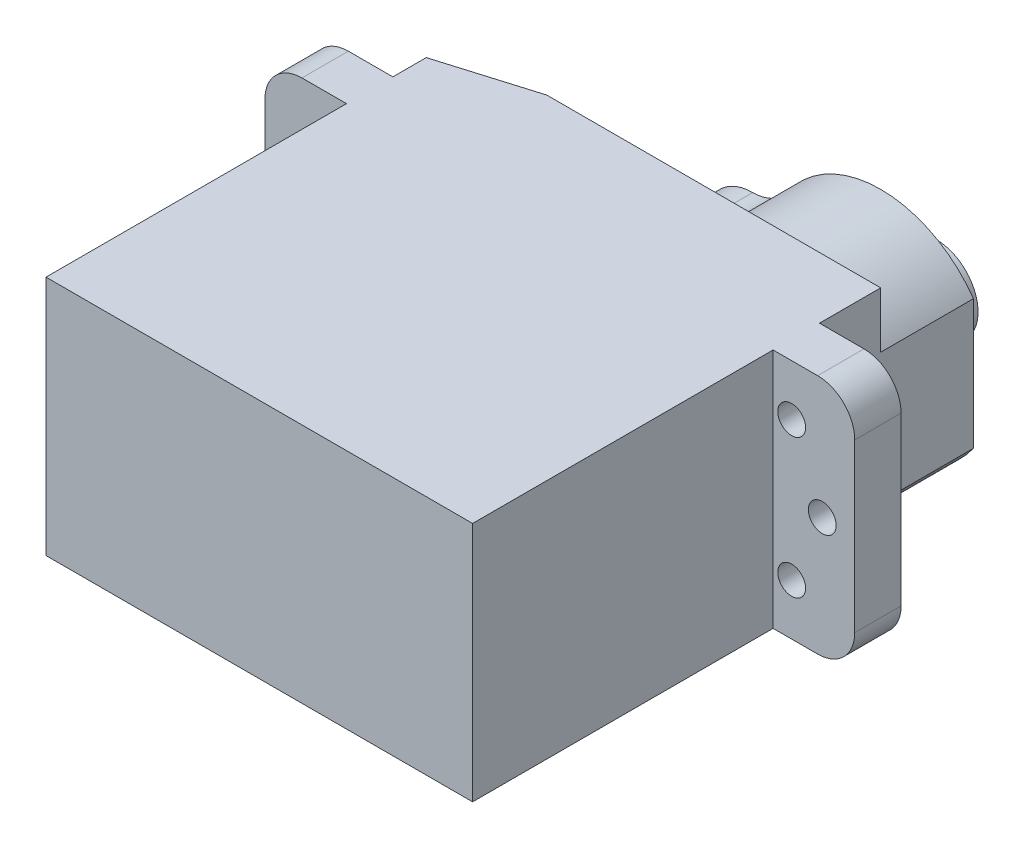
from build123d import *

# Parameters (mm, degrees)
BOSS_EXTRUDE1_DEPTH = 13
BOSS_EXTRUDE2_DEPTH = 5
FILLET1_R           = 2
SKETCH3_R           = 0.75
CUT_EXTRUDE1_DEPTH  = 4.9
SKETCH4_R           = 2.25
BOSS_EXTRUDE3_DEPTH = 3


with BuildPart() as part:
    # Sketch1 → Boss-Extrude1 (new body)
    with BuildSketch(Plane(origin=(0, 0, 0), x_dir=(1, 0, 0), z_dir=(0, 1, 0))):
        Polygon((0, 20.5), (5, 22), (11.5, 22), (23, 22), (23, 18.7), (27.4, 18.7), (27.4, 16.2), (23, 16.2), (23, 0), (0, 0), (0, 16.2), (-4.4, 16.2), (-4.4, 18.7), (0, 18.7), align=None)
    extrude(amount=BOSS_EXTRUDE1_DEPTH)

    # Sketch2 → Boss-Extrude2 (add)
    with BuildSketch(Plane(origin=(0, 0, -22), x_dir=(-1, 0, 0), z_dir=(0, 0, -1))):
        with BuildLine():
            Line((-23, 9.994281042), (-23, 3.005718958))
            ThreePointArc((-23, 3.005718958), (-17.997144773, 0.400000668), (-12.996731055, 3.010401189))
            ThreePointArc((-12.996731055, 3.010401189), (-12.16968389, 3.737727457), (-11.1, 4))
            ThreePointArc((-11.1, 4), (-8.6, 6.5), (-11.1, 9))
            ThreePointArc((-11.1, 9), (-12.16968389, 9.262272543), (-12.996731055, 9.989598811))
            ThreePointArc((-12.996731055, 9.989598811), (-17.997144773, 12.599999332), (-23, 9.994281042))
        make_face()
    extrude(amount=BOSS_EXTRUDE2_DEPTH)

    # Fillet1
    fillet1_edges = [part.edges().sort_by_distance(p)[0] for p in [
        (-4.4, 0, -17.45),
        (27.4, 13, -17.45),
        (27.4, 0, -17.45),
        (-4.4, 13, -17.45),
    ]]
    fillet(fillet1_edges, radius=FILLET1_R)

    # Sketch3 → Cut-Extrude1 (cut)
    with BuildSketch(Plane(origin=(0, 0, -18.7), x_dir=(-1, 0, 0), z_dir=(0, 0, -1))):
        with Locations((-25.65, 6.5)):
            Circle(SKETCH3_R)
        with Locations((-24, 10.25)):
            Circle(SKETCH3_R)
        with Locations((-24, 2.75)):
            Circle(SKETCH3_R)
        with Locations((1, 2.75)):
            Circle(SKETCH3_R)
        with Locations((2.65, 6.5)):
            Circle(SKETCH3_R)
        with Locations((1, 10.25)):
            Circle(SKETCH3_R)
    extrude(amount=-CUT_EXTRUDE1_DEPTH, mode=Mode.SUBTRACT)

    # Sketch4 → Boss-Extrude3 (add)
    with BuildSketch(Plane(origin=(0, 0, -27), x_dir=(-1, 0, 0), z_dir=(0, 0, -1))):
        with Locations((-18, 6.5)):
            Circle(SKETCH4_R)
    extrude(amount=BOSS_EXTRUDE3_DEPTH)


solid = part.part
